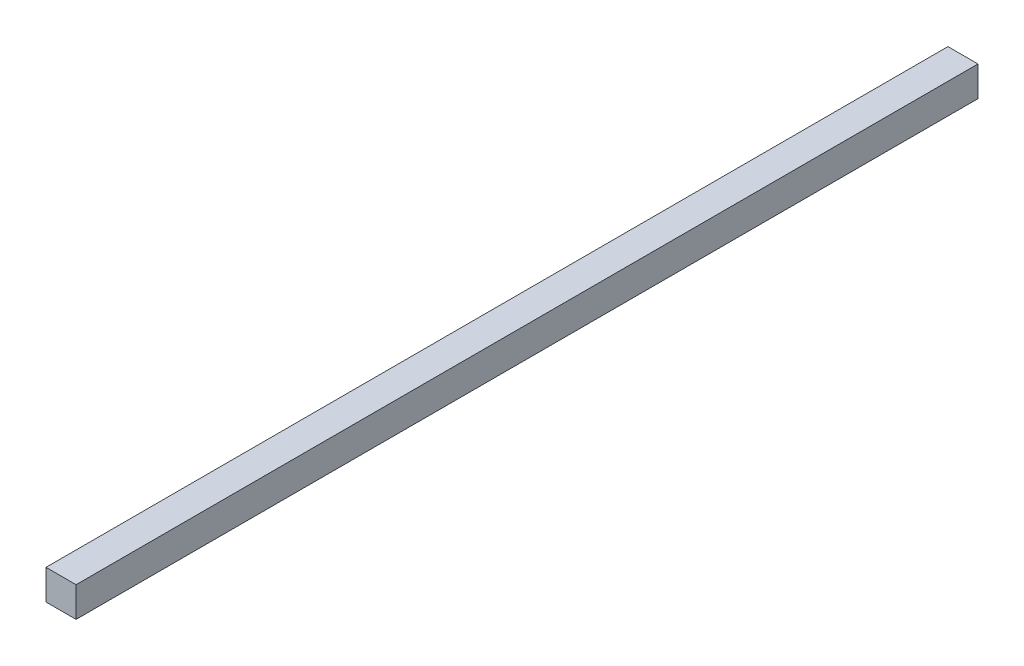
from build123d import *

# Parameters (mm, degrees)
SKETCH1_W           = 5
SKETCH1_H           = 5
BOSS_EXTRUDE1_DEPTH = 150


with BuildPart() as part:
    # Sketch1 → Boss-Extrude1 (new body)
    with BuildSketch(Plane.XY):
        Rectangle(SKETCH1_W, SKETCH1_H)
    extrude(amount=BOSS_EXTRUDE1_DEPTH)


solid = part.part
